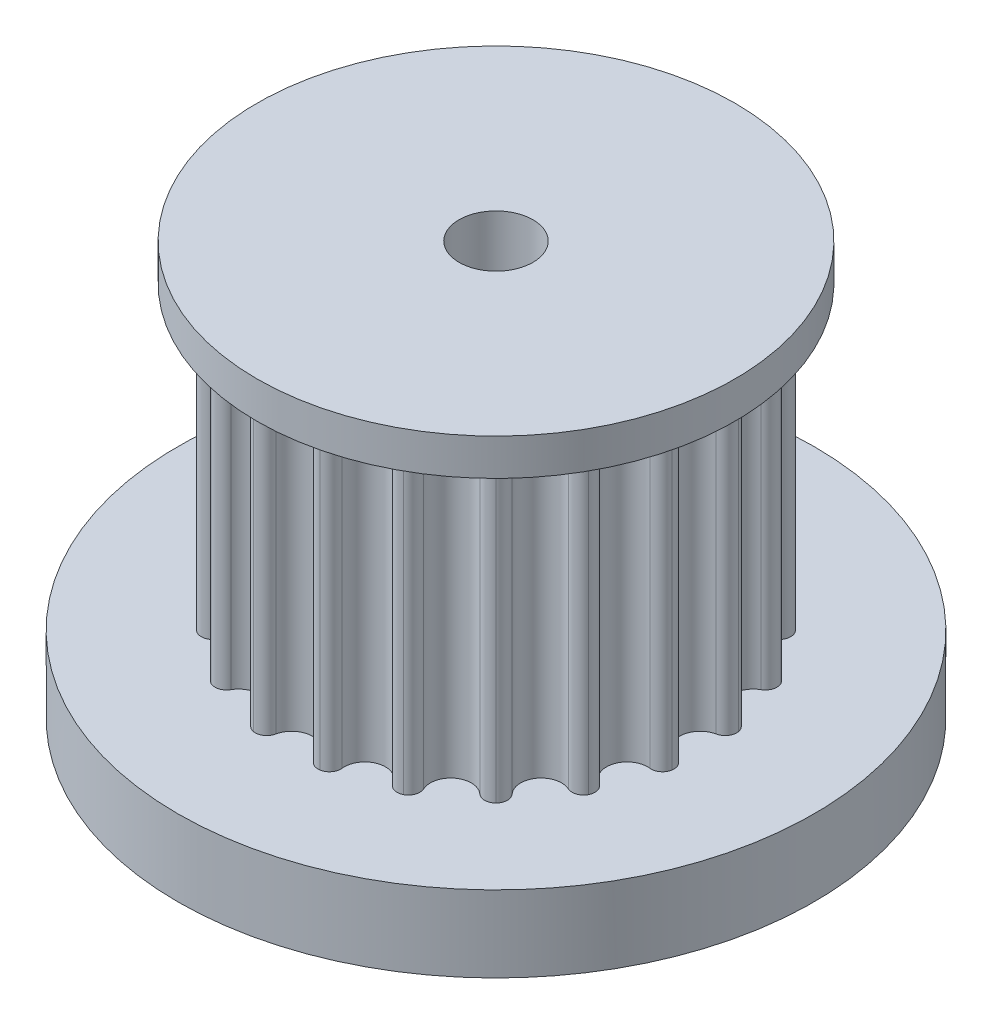
from build123d import *

# Parameters (mm, degrees)
BOSS_EXTRUDE1_DEPTH     = 6.499999954
CIRPATTERN1_COUNT       = 20
SKETCH2_W               = 10.342329408
SKETCH2_H               = 1.5875
CUT_EXTRUDE1_DEPTH      = 17.713324345
CUT_EXTRUDE1_DEPTH_BACK = 17.713324345
SKETCH3_R               = 1.6
SKETCH4_R               = 13.77
BOSS_EXTRUDE2_DEPTH     = 3.30250003
CUT_EXTRUDE2_DEPTH      = 13.208


with BuildPart() as part:
    # Sketch1 → Boss-Extrude1 (new, symmetric)
    with BuildSketch(Plane(origin=(0, 0, 0), x_dir=(1, 0, 0), z_dir=(0, 1, 0))):
        with BuildLine():
            ThreePointArc((0.872060607, 8.659786465), (0.562967303, 8.148255135), (0, 7.947579308))
            ThreePointArc((0, 7.947579308), (-1.243275317, -7.849731418), (2.45593707, 7.55859709))
            ThreePointArc((2.45593707, 7.55859709), (1.982535589, 7.923417607), (1.846642263, 8.505427895))
            ThreePointArc((1.846642263, 8.505427895), (1.749626992, 8.862101959), (1.434119122, 9.054671776))
            ThreePointArc((1.434119122, 9.054671776), (1.074545959, 8.969024291), (0.872060607, 8.659786465))
        make_face()
    boss_extrude1 = extrude(amount=BOSS_EXTRUDE1_DEPTH, both=True)

    # CirPattern1: Boss-Extrude1 ×20 about axis
    cirpattern1_axis = Axis((0, 0, 0), (0, 1, 0))
    for i in range(1, CIRPATTERN1_COUNT):
        add(boss_extrude1.rotate(cirpattern1_axis, i * 360 / CIRPATTERN1_COUNT))

    # Sketch2 → Revolve3 (revolve)
    with BuildSketch(Plane(origin=(0, 0, 0), x_dir=(0, 0, -1), z_dir=(1, 0, 0)), mode=Mode.PRIVATE) as revolve3_sk:
        with Locations((5.171164704, 7.293749954)):
            Rectangle(SKETCH2_W, SKETCH2_H)
    revolve(revolve3_sk.sketch.rotate(Axis((0, 3.3, 0), (0, -1, 0)), 180), axis=Axis((0, 3.3, 0), (0, -1, 0)))

    # Sketch3 → Cut-Extrude1 (cut, two sides: drawn at the far end of the back side and taken through both)
    with BuildSketch(Plane(origin=(0, 0, 0), x_dir=(-1, 0, 0), z_dir=(0, -1, 0)).offset(-CUT_EXTRUDE1_DEPTH_BACK)):
        with Locations(Location((0, 0, 0), (0, 0, 90))):
            Circle(SKETCH3_R)
    extrude(amount=CUT_EXTRUDE1_DEPTH + CUT_EXTRUDE1_DEPTH_BACK, mode=Mode.SUBTRACT)

    # Sketch4 → Boss-Extrude2 (add)
    with BuildSketch(Plane(origin=(0, -9.802499984, 0), x_dir=(1, 0, 0), z_dir=(0, 1, 0))):
        with Locations(Location((0, 0, 0), (0, 0, 270))):
            Circle(SKETCH4_R)
    extrude(amount=BOSS_EXTRUDE2_DEPTH)

    # Sketch5 → Cut-Extrude2 (cut)
    with BuildSketch(Plane(origin=(0, -9.802499984, 0), x_dir=(1, 0, 0), z_dir=(0, 1, 0))):
        Polygon((-2.917259676, 4.661702584), (-5.495782701, -0.195569697), (-2.578523025, -4.857272281), (2.917259676, -4.661702584), (5.495782701, 0.195569697), (2.578523025, 4.857272281), align=None)
    extrude(amount=CUT_EXTRUDE2_DEPTH, mode=Mode.SUBTRACT)


solid = part.part
